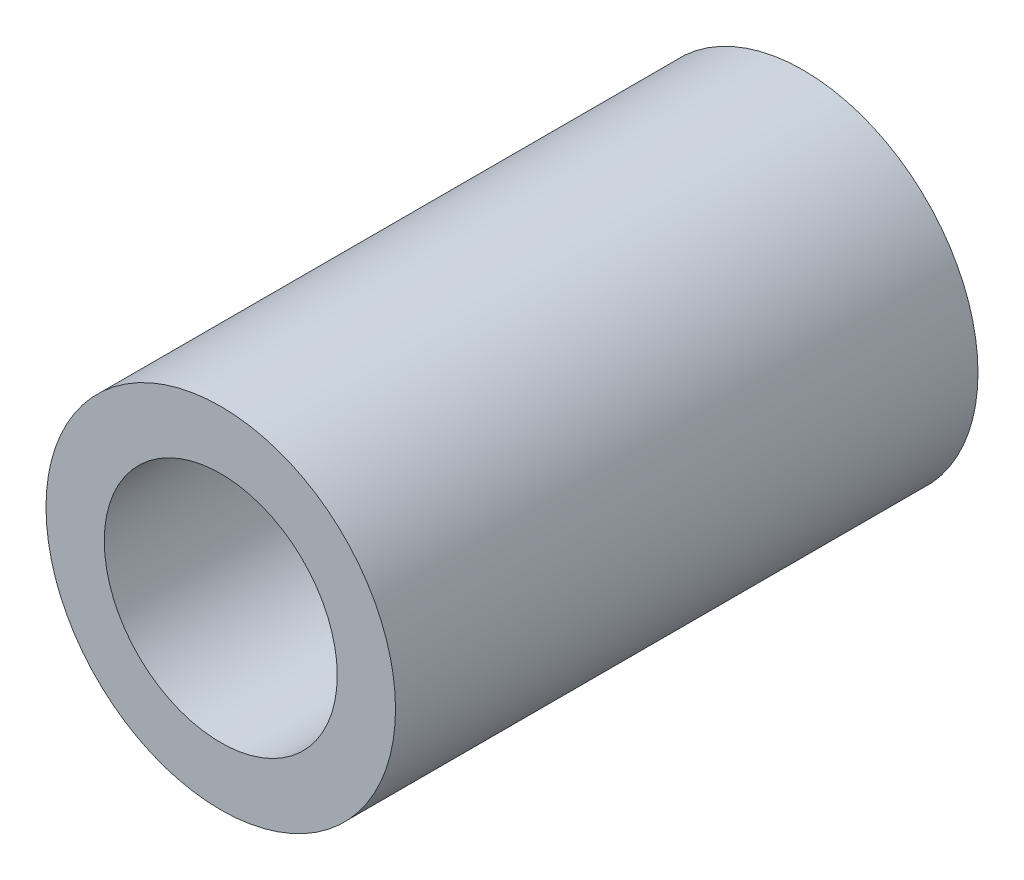
from build123d import *

# Parameters (mm, degrees)
SKETCH1_R           = 76.2
SKETCH1_R_2         = 50.8
BOSS_EXTRUDE1_DEPTH = 127


with BuildPart() as part:
    # Sketch1 → Boss-Extrude1 (new, symmetric)
    with BuildSketch(Plane.XY):
        Circle(SKETCH1_R)
        Circle(SKETCH1_R_2, mode=Mode.SUBTRACT)
    extrude(amount=BOSS_EXTRUDE1_DEPTH, both=True)


solid = part.part
